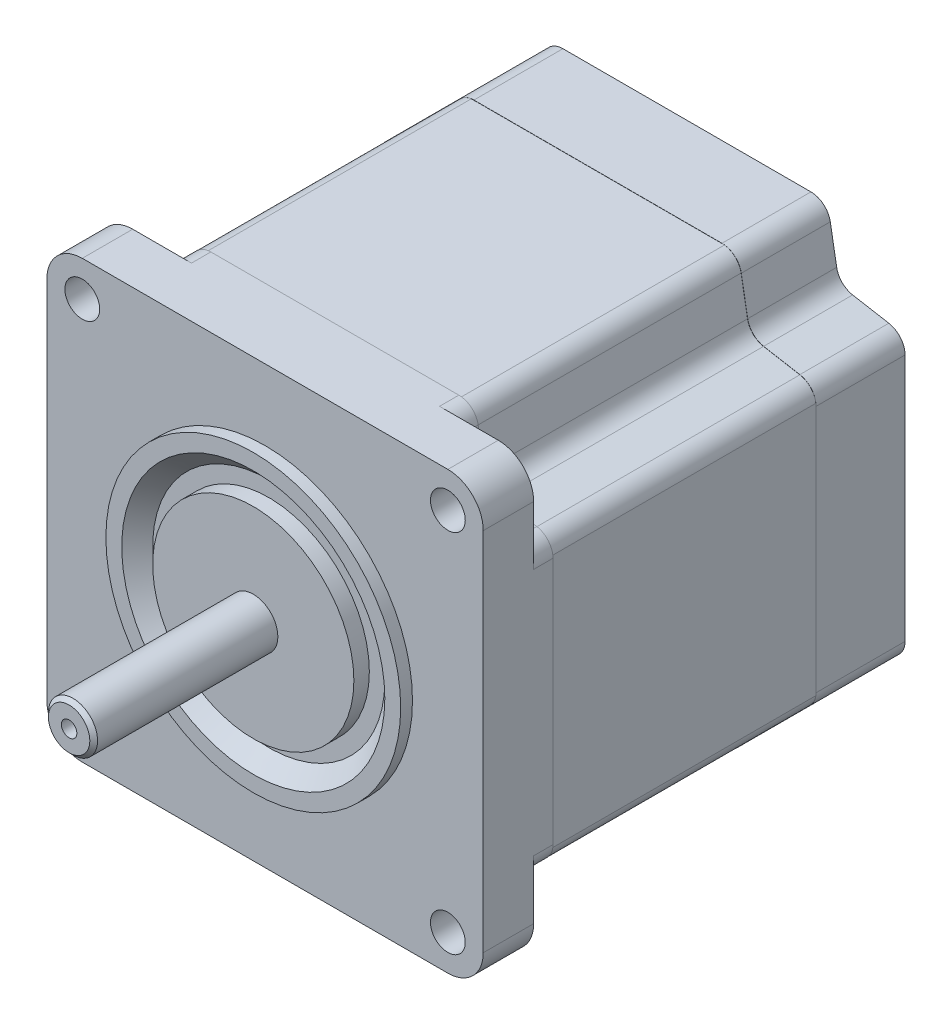
from build123d import *

# Parameters (mm, degrees)
SKETCH1_R             = 2.2479
EXTRUDE1_DEPTH        = 9.017
SKETCH2_R             = 19.05
EXTRUDE2_DEPTH        = 1.524
SKETCH3_R             = 3.175
EXTRUDE3_DEPTH        = 23.8
EXTRUDE5_DEPTH        = 34
CUT_EXTRUDE2_START    = -34
CUT_EXTRUDE2_DEPTH    = 34
EXTRUDE7_DEPTH        = 11.5
CUT_EXTRUDE3_START    = -48
CUT_EXTRUDE3_DEPTH    = 48
EXTRUDE8_DEPTH        = 5
CHANFRO1_SIZE         = 0.5
ESBO_O1_R             = 1
CORTE_EXTRUS_O1_DEPTH = 2


with BuildPart() as part:
    # Sketch1 → Extrude1 (new body)
    with BuildSketch(Plane.XY):
        with BuildLine():
            Line((-4.572, 0), (-51.816, 0))
            ThreePointArc((-51.816, 0), (-55.048892204, 1.339107796), (-56.388, 4.572))
            Line((-56.388, 4.572), (-56.388, 51.816))
            ThreePointArc((-56.388, 51.816), (-55.048892204, 55.048892204), (-51.816, 56.388))
            Line((-51.816, 56.388), (-4.572, 56.388))
            ThreePointArc((-4.572, 56.388), (-1.339107796, 55.048892204), (0, 51.816))
            Line((0, 51.816), (0, 4.572))
            ThreePointArc((0, 4.572), (-1.339107796, 1.339107796), (-4.572, 0))
        make_face()
        with Locations((-4.572, 51.816)):
            Circle(SKETCH1_R, mode=Mode.SUBTRACT)
        with Locations((-4.572, 4.572)):
            Circle(SKETCH1_R, mode=Mode.SUBTRACT)
        with Locations((-51.816, 4.572)):
            Circle(SKETCH1_R, mode=Mode.SUBTRACT)
        with Locations((-51.816, 51.816)):
            Circle(SKETCH1_R, mode=Mode.SUBTRACT)
    extrude(amount=-EXTRUDE1_DEPTH)

    # Sketch2 → Extrude2 (add)
    with BuildSketch(Plane.XY):
        with Locations(Location((-28.194, 28.194, 0), (0, 0, 180))):
            Circle(SKETCH2_R)
    extrude(amount=EXTRUDE2_DEPTH)

    # Sketch3 → Extrude3 (add)
    with BuildSketch(Plane.XY.offset(1.524)):
        with Locations((-28.194, 28.194)):
            Circle(SKETCH3_R)
    extrude(amount=EXTRUDE3_DEPTH)

    # Sketch5 → Extrude5 (add)
    with BuildSketch(Plane(origin=(0, 0, -9.017), x_dir=(-1, 0, 0), z_dir=(0, 0, -1))):
        with BuildLine():
            Line((4.572, 0.0254), (51.816, 0.0254))
            ThreePointArc((51.816, 0.0254), (55.030931691, 1.357068309), (56.3626, 4.572))
            Line((56.3626, 4.572), (56.3626, 51.816))
            ThreePointArc((56.3626, 51.816), (55.030931691, 55.030931691), (51.816, 56.3626))
            Line((51.816, 56.3626), (4.572, 56.3626))
            ThreePointArc((4.572, 56.3626), (1.357068309, 55.030931691), (0.0254, 51.816))
            Line((0.0254, 51.816), (0.0254, 4.572))
            ThreePointArc((0.0254, 4.572), (1.357068309, 1.357068309), (4.572, 0.0254))
        make_face()
    extrude(amount=EXTRUDE5_DEPTH)

    # Sketch7 → Cut-Extrude2 (cut)
    with BuildSketch(Plane(origin=(0, 0, -43.017), x_dir=(-1, 0, 0), z_dir=(0, 0, -1)).offset(CUT_EXTRUDE2_START)):
        with BuildLine():
            Line((2.098933629, 46.697411693), (6.801120561, 47.526534117))
            ThreePointArc((6.801120561, 47.526534117), (8.156105414, 48.231894586), (8.861465883, 49.586879439))
            Line((8.861465883, 49.586879439), (9.690588307, 54.289066371))
            ThreePointArc((9.690588307, 54.289066371), (10.559319471, 55.793752886), (12.192, 56.388))
            Line((12.192, 56.388), (4.572, 56.388))
            ThreePointArc((4.572, 56.388), (1.339107796, 55.048892204), (0, 51.816))
            Line((0, 51.816), (0, 44.196))
            ThreePointArc((0, 44.196), (0.594247114, 45.828680529), (2.098933629, 46.697411693))
        make_face()
        with BuildLine():
            Line((56.388, 51.816), (56.388, 44.196))
            ThreePointArc((56.388, 44.196), (55.793752886, 45.828680529), (54.289066371, 46.697411693))
            Line((54.289066371, 46.697411693), (49.586879439, 47.526534117))
            ThreePointArc((49.586879439, 47.526534117), (48.231894586, 48.231894586), (47.526534117, 49.586879439))
            Line((47.526534117, 49.586879439), (46.697411693, 54.289066371))
            ThreePointArc((46.697411693, 54.289066371), (45.828680529, 55.793752886), (44.196, 56.388))
            Line((44.196, 56.388), (51.816, 56.388))
            ThreePointArc((51.816, 56.388), (55.048892204, 55.048892204), (56.388, 51.816))
        make_face()
        with BuildLine():
            Line((54.289066371, 9.690588307), (49.586879439, 8.861465883))
            ThreePointArc((49.586879439, 8.861465883), (48.231894586, 8.156105414), (47.526534117, 6.801120561))
            Line((47.526534117, 6.801120561), (46.697411693, 2.098933629))
            ThreePointArc((46.697411693, 2.098933629), (45.828680529, 0.594247114), (44.196, 0))
            Line((44.196, 0), (51.816, 0))
            ThreePointArc((51.816, 0), (55.048892204, 1.339107796), (56.388, 4.572))
            Line((56.388, 4.572), (56.388, 12.192))
            ThreePointArc((56.388, 12.192), (55.793752886, 10.559319471), (54.289066371, 9.690588307))
        make_face()
        with BuildLine():
            Line((0, 4.572), (0, 12.192))
            ThreePointArc((0, 12.192), (0.594247114, 10.559319471), (2.098933629, 9.690588307))
            Line((2.098933629, 9.690588307), (6.801120561, 8.861465883))
            ThreePointArc((6.801120561, 8.861465883), (8.156105414, 8.156105414), (8.861465883, 6.801120561))
            Line((8.861465883, 6.801120561), (9.690588307, 2.098933629))
            ThreePointArc((9.690588307, 2.098933629), (10.559319471, 0.594247114), (12.192, 0))
            Line((12.192, 0), (4.572, 0))
            ThreePointArc((4.572, 0), (1.339107796, 1.339107796), (0, 4.572))
        make_face()
    extrude(amount=CUT_EXTRUDE2_DEPTH, mode=Mode.SUBTRACT)

    # Sketch6 → Extrude7 (add)
    with BuildSketch(Plane(origin=(0, 0, -43.017), x_dir=(-1, 0, 0), z_dir=(0, 0, -1))):
        with BuildLine():
            Line((0, 51.816), (0, 4.572))
            ThreePointArc((0, 4.572), (1.339107796, 1.339107796), (4.572, 0))
            Line((4.572, 0), (51.816, 0))
            ThreePointArc((51.816, 0), (55.048892204, 1.339107796), (56.388, 4.572))
            Line((56.388, 4.572), (56.388, 51.816))
            ThreePointArc((56.388, 51.816), (55.048892204, 55.048892204), (51.816, 56.388))
            Line((51.816, 56.388), (4.572, 56.388))
            ThreePointArc((4.572, 56.388), (1.339107796, 55.048892204), (0, 51.816))
        make_face()
    extrude(amount=EXTRUDE7_DEPTH)

    # Sketch8 → Cut-Extrude3 (cut)
    with BuildSketch(Plane(origin=(0, 0, -54.517), x_dir=(-1, 0, 0), z_dir=(0, 0, -1)).offset(CUT_EXTRUDE3_START)):
        with BuildLine():
            Line((2.098933629, 46.722811693), (6.779527926, 47.548126753))
            ThreePointArc((6.779527926, 47.548126753), (8.134512779, 48.253487221), (8.839873247, 49.608472074))
            Line((8.839873247, 49.608472074), (9.665188307, 54.289066371))
            ThreePointArc((9.665188307, 54.289066371), (10.533919471, 55.793752886), (12.1666, 56.388))
            Line((12.1666, 56.388), (4.572, 56.388))
            ThreePointArc((4.572, 56.388), (1.339107796, 55.048892204), (0, 51.816))
            Line((0, 51.816), (0, 44.2214))
            ThreePointArc((0, 44.2214), (0.594247114, 45.854080529), (2.098933629, 46.722811693))
        make_face()
        with BuildLine():
            Line((56.388, 51.816), (56.388, 44.2214))
            ThreePointArc((56.388, 44.2214), (55.793752886, 45.854080529), (54.289066371, 46.722811693))
            Line((54.289066371, 46.722811693), (49.608472074, 47.548126753))
            ThreePointArc((49.608472074, 47.548126753), (48.253487221, 48.253487221), (47.548126753, 49.608472074))
            Line((47.548126753, 49.608472074), (46.722811693, 54.289066371))
            ThreePointArc((46.722811693, 54.289066371), (45.854080529, 55.793752886), (44.2214, 56.388))
            Line((44.2214, 56.388), (51.816, 56.388))
            ThreePointArc((51.816, 56.388), (55.048892204, 55.048892204), (56.388, 51.816))
        make_face()
        with BuildLine():
            Line((54.289066371, 9.665188307), (49.608472074, 8.839873247))
            ThreePointArc((49.608472074, 8.839873247), (48.253487221, 8.134512779), (47.548126753, 6.779527926))
            Line((47.548126753, 6.779527926), (46.722811693, 2.098933629))
            ThreePointArc((46.722811693, 2.098933629), (45.854080529, 0.594247114), (44.2214, 0))
            Line((44.2214, 0), (51.816, 0))
            ThreePointArc((51.816, 0), (55.048892204, 1.339107796), (56.388, 4.572))
            Line((56.388, 4.572), (56.388, 12.1666))
            ThreePointArc((56.388, 12.1666), (55.793752886, 10.533919471), (54.289066371, 9.665188307))
        make_face()
        with BuildLine():
            Line((0, 4.572), (0, 12.1666))
            ThreePointArc((0, 12.1666), (0.594247114, 10.533919471), (2.098933629, 9.665188307))
            Line((2.098933629, 9.665188307), (6.779527926, 8.839873247))
            ThreePointArc((6.779527926, 8.839873247), (8.134512779, 8.134512779), (8.839873247, 6.779527926))
            Line((8.839873247, 6.779527926), (9.665188307, 2.098933629))
            ThreePointArc((9.665188307, 2.098933629), (10.533919471, 0.594247114), (12.1666, 0))
            Line((12.1666, 0), (4.572, 0))
            ThreePointArc((4.572, 0), (1.339107796, 1.339107796), (0, 4.572))
        make_face()
    extrude(amount=CUT_EXTRUDE3_DEPTH, mode=Mode.SUBTRACT)

    # Sketch9 → Extrude8 (add)
    with BuildSketch(Plane.XZ):
        Polygon((-38.444, -54.517), (-17.944, -54.517), (-17.944, -43.017), (-18.944, -43.017), (-18.944, -50.517), (-37.444, -50.517), (-37.444, -43.017), (-38.444, -43.017), align=None)
    extrude(amount=EXTRUDE8_DEPTH)

    # Chanfro1
    chanfro1_edges = [part.edges().sort_by_distance(p)[0] for p in [
        (-31.369, 28.194, 25.324),
    ]]
    chamfer(chanfro1_edges, length=CHANFRO1_SIZE)

    # Esboço1 → Corte-extrusão1 (cut)
    with BuildSketch(Plane.XY.offset(25.324)):
        with Locations((-28.194, 28.194)):
            Circle(ESBO_O1_R)
    extrude(amount=-CORTE_EXTRUS_O1_DEPTH, mode=Mode.SUBTRACT)

    # Esboço2 → Corte-Revolução1 (revolve, cut)
    with BuildSketch(Plane(origin=(0, 28.194, 0), x_dir=(-1, 0, 0), z_dir=(0, 1, 0))):
        Polygon((11.194, 1.524), (13.194, -0.476), (15.194, -0.476), (15.194, 1.524), align=None)
    revolve(axis=Axis((-28.194, 28.194, 25.324), (0, 0, -1)), mode=Mode.SUBTRACT)


solid = part.part
